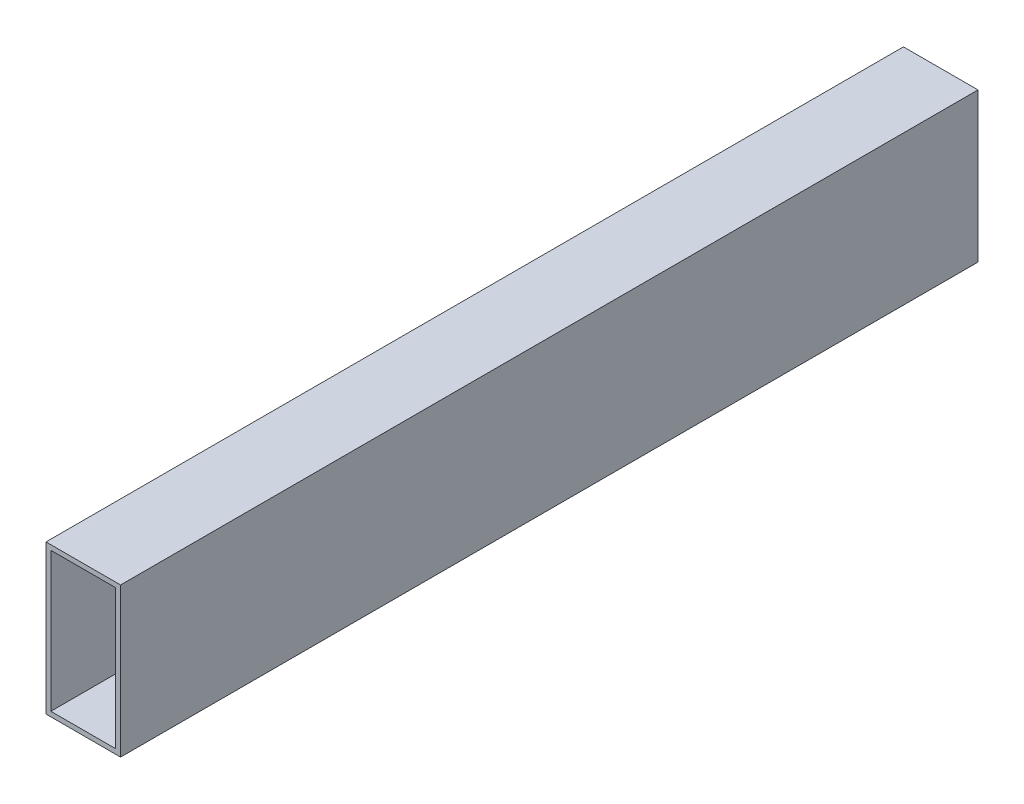
from build123d import *

# Parameters (mm, degrees)
SKETCH1_W           = 25.4
SKETCH1_H           = 50.8
BOSS_EXTRUDE1_DEPTH = 292.1
SKETCH2_W           = 22.098
SKETCH2_H           = 47.498
CUT_EXTRUDE1_DEPTH  = 298.624895009


with BuildPart() as part:
    # Sketch1 → Boss-Extrude1 (new body)
    with BuildSketch(Plane.XY):
        with Locations((-35.737209302, -4.799418605)):
            Rectangle(SKETCH1_W, SKETCH1_H)
    extrude(amount=BOSS_EXTRUDE1_DEPTH)

    # Sketch2 → Cut-Extrude1 (cut, through all)
    with BuildSketch(Plane.XY.offset(292.1)):
        with Locations((-35.737209302, -4.799418605)):
            Rectangle(SKETCH2_W, SKETCH2_H)
    extrude(amount=-CUT_EXTRUDE1_DEPTH, mode=Mode.SUBTRACT)


solid = part.part
